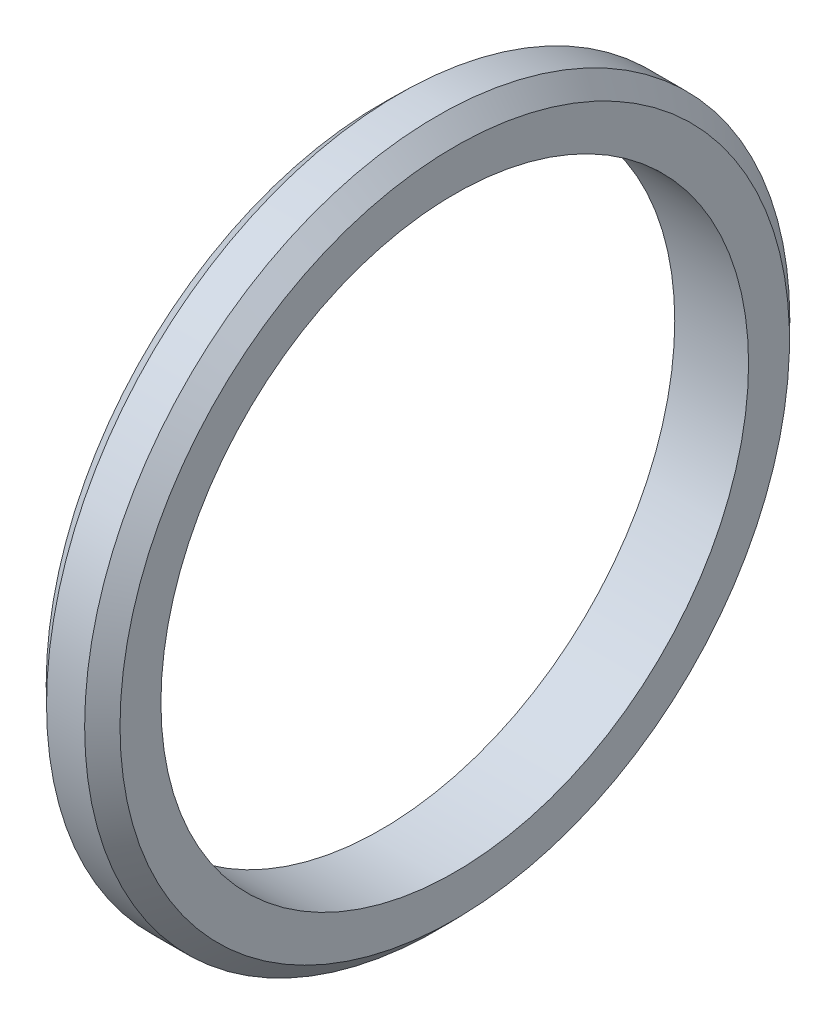
from build123d import *


with BuildPart() as part:
    # Sketch3 → Revolve1 (revolve)
    with BuildSketch(Plane(origin=(0, 0, 0), x_dir=(1, 0, 0), z_dir=(0, 1, 0)), mode=Mode.PRIVATE) as revolve1_sk:
        Polygon((-1.9939, 15.875), (1.9939, 15.875), (1.9939, 18.085890284), (1.046884034, 19.05), (-1.01238799, 19.05), (-1.9939, 18.085890284), align=None)
    revolve(revolve1_sk.sketch.rotate(Axis((0, 0, 0), (1, 0, 0)), 180), axis=Axis((0, 0, 0), (1, 0, 0)))


solid = part.part
